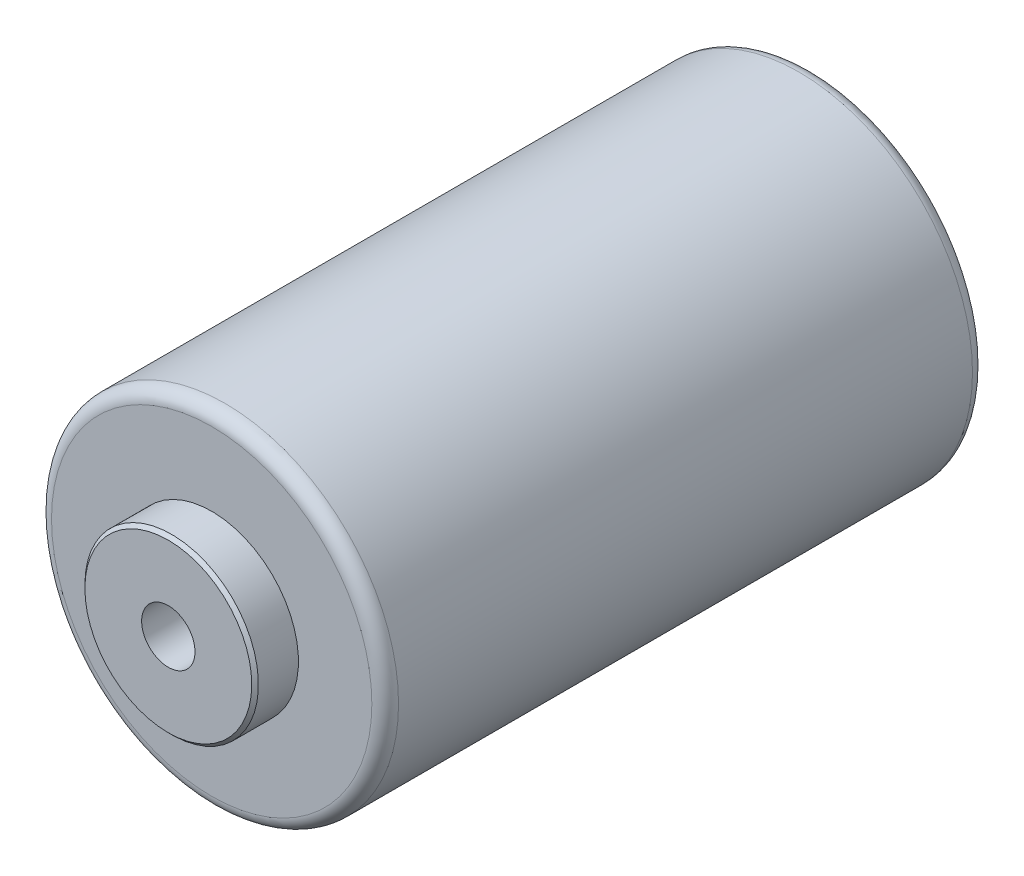
from build123d import *

# Parameters (mm, degrees)
SKICA1_R                 = 26
P_IDAT_VYSUNUT_M1_DEPTH  = 90
ZAOBLIT1_R               = 2
SKICA2_R                 = 13
P_IDAT_VYSUNUT_M2_DEPTH  = 6.5
SKICA4_R                 = 1.6
ODEBRAT_VYSUNUT_M1_DEPTH = 10
P_IDAT_START             = 6.5
SKICA5_R                 = 13
P_IDAT_VYSUNUT_M4_DEPTH  = 6.5
ZKOSEN_1_SIZE            = 0.5
SKICA8_R                 = 4
ODEBRAT_VYSUNUT_M3_DEPTH = 110.366356825


with BuildPart() as part:
    # Skica1 → Přidat vysunutím1 (new body)
    with BuildSketch(Plane.XY):
        with Locations(Location((0, 0, 0), (0, 0, 180))):
            Circle(SKICA1_R)
    extrude(amount=P_IDAT_VYSUNUT_M1_DEPTH)

    # Zaoblit1
    zaoblit1_edges = [part.edges().sort_by_distance(p)[0] for p in [
        (26, 0, 0),
        (26, 0, 90),
    ]]
    fillet(zaoblit1_edges, radius=ZAOBLIT1_R)

    # Skica2 → Přidat vysunutím2 (add)
    with BuildSketch(Plane(origin=(0, 0, 0), x_dir=(-1, 0, 0), z_dir=(0, 0, -1))):
        with Locations(Location((0, 0, 0), (0, 0, 180))):
            Circle(SKICA2_R)
    extrude(amount=P_IDAT_VYSUNUT_M2_DEPTH)

    # Skica4 → Odebrat vysunutím1 (cut)
    with BuildSketch(Plane(origin=(0, 0, 0), x_dir=(-1, 0, 0), z_dir=(0, 0, -1))):
        with Locations((-17.5, 0)):
            Circle(SKICA4_R)
        with Locations((0, 17.5)):
            Circle(SKICA4_R)
        with Locations((17.5, 0)):
            Circle(SKICA4_R)
        with Locations((0, -17.5)):
            Circle(SKICA4_R)
    extrude(amount=-ODEBRAT_VYSUNUT_M1_DEPTH, mode=Mode.SUBTRACT)

    # Skica5 → Přidat vysunutím4 (add)
    with BuildSketch(Plane.XY.offset(90).offset(P_IDAT_START)):
        Circle(SKICA5_R)
    extrude(amount=-P_IDAT_VYSUNUT_M4_DEPTH)

    # Zkosení1
    zkosen_1_edges = [part.edges().sort_by_distance(p)[0] for p in [
        (-13, 0, -6.5),
        (-13, 0, 96.5),
    ]]
    chamfer(zkosen_1_edges, length=ZKOSEN_1_SIZE)

    # Skica8 → Odebrat vysunutím3 (cut, through all)
    with BuildSketch(Plane(origin=(0, 0, -6.5), x_dir=(-1, 0, 0), z_dir=(0, 0, -1))):
        Circle(SKICA8_R)
    extrude(amount=-ODEBRAT_VYSUNUT_M3_DEPTH, mode=Mode.SUBTRACT)


solid = part.part
